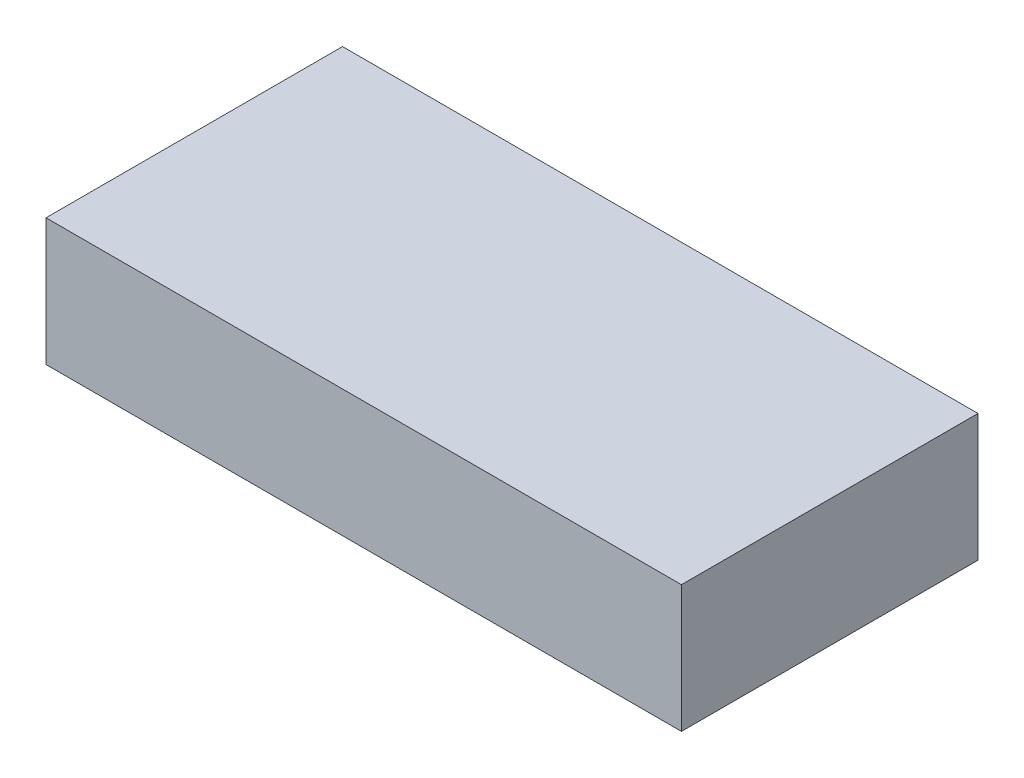
from build123d import *

# Parameters (mm, degrees)
SKETCH1_W           = 75
SKETCH1_H           = 35
BOSS_EXTRUDE1_DEPTH = 15


with BuildPart() as part:
    # Sketch1 → Boss-Extrude1 (new body)
    with BuildSketch(Plane(origin=(0, 0, 0), x_dir=(1, 0, 0), z_dir=(0, 1, 0))):
        with Locations((-2.948430493, 0.795964126)):
            Rectangle(SKETCH1_W, SKETCH1_H)
    extrude(amount=BOSS_EXTRUDE1_DEPTH)


solid = part.part
